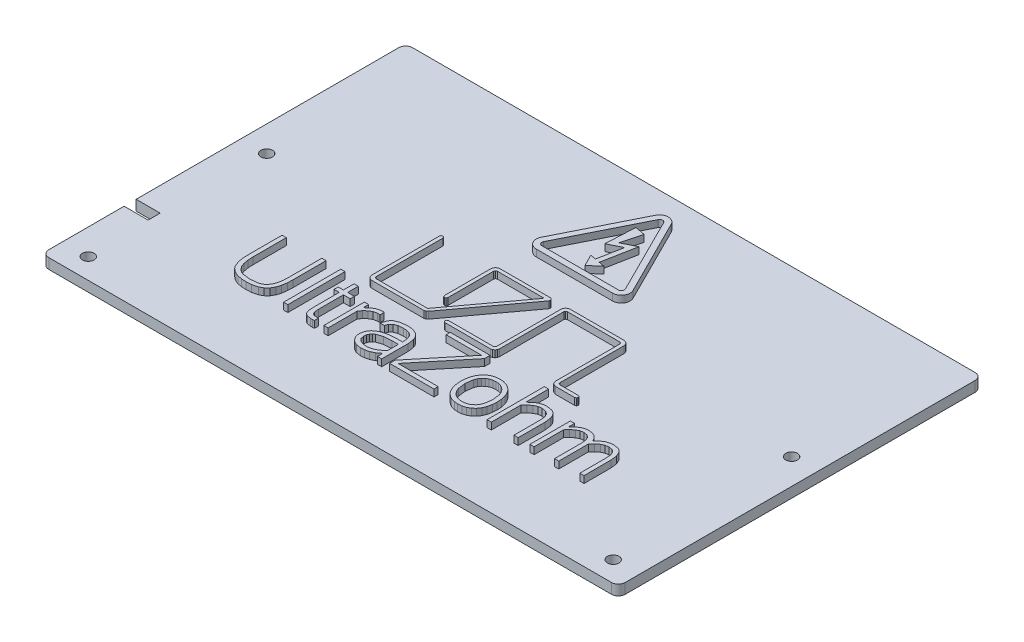
from build123d import *

# Parameters (mm, degrees)
AUFSATZ_LINEAR_AUSTRAGEN1_DEPTH = 3
SKIZZE4_W                       = 7
SKIZZE4_H                       = 3.5
SCHNITT_LINEAR_AUSTRAGEN3_DEPTH = 3
SKIZZE9_W                       = 1.236063568
SKIZZE9_H                       = 16.679437304
AUFSATZ_LINEAR_AUSTRAGEN2_DEPTH = 2
SKIZZE10_R                      = 1.7
SCHNITT_LINEAR_AUSTRAGEN4_DEPTH = 100.368002898
AUFSATZ_LINEAR_AUSTRAGEN3_DEPTH = 2


with BuildPart() as part:
    # Skizze1 → Aufsatz-Linear austragen1 (new body)
    with BuildSketch(Plane(origin=(0, 0, 0), x_dir=(1, 0, 0), z_dir=(0, 1, 0))):
        with BuildLine():
            Line((-82, -53), (82, -53))
            ThreePointArc((82, -53), (83.414213562, -52.414213562), (84, -51))
            Line((84, -51), (84, 51))
            ThreePointArc((84, 51), (83.414213562, 52.414213562), (82, 53))
            Line((82, 53), (-82, 53))
            ThreePointArc((-82, 53), (-83.414213562, 52.414213562), (-84, 51))
            Line((-84, 51), (-84, -51))
            ThreePointArc((-84, -51), (-83.414213562, -52.414213562), (-82, -53))
        make_face()
    extrude(amount=AUFSATZ_LINEAR_AUSTRAGEN1_DEPTH)

    # Skizze4 → Schnitt-Linear austragen3 (cut)
    with BuildSketch(Plane(origin=(0, 3, 0), x_dir=(1, 0, 0), z_dir=(0, 1, 0))):
        with Locations((-80.5, -27.3)):
            Rectangle(SKIZZE4_W, SKIZZE4_H)
    extrude(amount=-SCHNITT_LINEAR_AUSTRAGEN3_DEPTH, mode=Mode.SUBTRACT)

    # Skizze9 → Aufsatz-Linear austragen2 (add)
    # profile 1 of 11: a face of its own
    with BuildSketch(Plane(origin=(0, 3, 0), x_dir=(1, 0, 0), z_dir=(0, 1, 0))):
        Polygon((-12.039092375, -13.675479008), (-27.170980831, -13.675479008), (-27.701356199, -13.567530024), (-28.134310375, -13.274919992), (-28.426135039, -12.841435464), (-28.533121871, -12.310865024), (-28.533121871, 7.337595552), (-28.381067311, 7.704687528), (-28.013975335, 7.856742088), (-27.648480511, 7.7038158), (-27.497301743, 7.337595552), (-27.497301743, -12.108150672), (-27.345098847, -12.474371936), (-26.978155207, -12.62482528), (-12.039092375, -12.62482528), (-11.930324495, -12.56795976), (2.299238105, 6.714623976), (2.311539833, 6.858130928), (2.187994233, 6.932171928), (-11.228238015, 6.932171928), (-11.595333039, 6.780118384), (-11.747388615, 6.413025392), (-11.747388615, -6.906791504), (-11.897839927, -7.273732096), (-12.264055095, -7.42593804), (-12.631150119, -7.273884496), (-12.783205695, -6.906791504), (-12.783205695, 6.595962288), (-12.676161967, 7.126167984), (-12.384244847, 7.559139432), (-11.951274415, 7.851058584), (-11.421068719, 7.958103328), (3.164480977, 7.958103328), (3.535614601, 7.87180124), (3.797830993, 7.595339512), (3.864397281, 7.22016424), (3.713297761, 6.870368648), (-11.102156479, -13.181048704), (-11.514970487, -13.533725672), align=None)
    # profile 2 of 11: a face of its own
    with BuildSketch(Plane(origin=(0, 3, 0), x_dir=(1, 0, 0), z_dir=(0, 1, 0))):
        Polygon((31.937562369, -13.675479008), (26.390110929, -13.675479008), (25.859735561, -13.567530024), (25.426781385, -13.274919992), (25.134956721, -12.841435464), (25.027969889, -12.310865024), (25.027969889, 6.405603512), (24.876790105, 6.771824776), (24.511293249, 6.924750048), (9.218725409, 6.924750048), (8.853228553, 6.771824776), (8.702048769, 6.405603512), (8.702048769, -12.298504368), (8.602210513, -12.823374032), (8.308500153, -13.269681496), (7.865941729, -13.569011352), (7.342376609, -13.675479008), (-5.851360783, -13.675479008), (-6.218455807, -13.523425464), (-6.370511383, -13.156332472), (-6.218455807, -12.78923948), (-5.851360783, -12.637185936), (7.147081089, -12.637185936), (7.514016601, -12.486728528), (7.666216449, -12.120511328), (7.666216449, 6.595957208), (7.769904329, 7.1172282), (8.065182377, 7.559139432), (8.507095641, 7.854414432), (9.028367649, 7.958098248), (24.701640849, 7.958098248), (25.222912857, 7.854414432), (25.664826121, 7.559139432), (25.960104169, 7.1172282), (26.063792049, 6.595957208), (26.063792049, -12.1106226), (26.215994945, -12.476842848), (26.582937569, -12.627297208), (31.937562369, -12.627297208), (32.303052113, -12.780225528), (32.454228849, -13.146443744), (32.306584745, -13.51906276), align=None)
    # profile 3 of 11: a face of its own
    with BuildSketch(Plane(origin=(0, 3, 0), x_dir=(1, 0, 0), z_dir=(0, 1, 0))):
        Polygon((-45.244696271, -32.340032992), (-46.541147831, -32.274633072), (-47.815708655, -32.028544664), (-48.741563039, -31.686347736), (-49.590694183, -31.183077216), (-50.213803935, -30.61553352), (-50.710567991, -29.934654008), (-51.340960431, -28.41182444), (-51.610421919, -26.735722128), (-51.664808399, -25.044788248), (-51.664808399, -15.35652416), (-50.428745847, -15.35652416), (-50.428745847, -24.997817552), (-50.361680703, -26.559673712), (-50.082647479, -28.097864184), (-49.693990903, -29.09524192), (-49.069075719, -29.964319176), (-48.317399295, -30.533673384), (-47.439944103, -30.879005688), (-45.237280487, -31.126218808), (-43.012366471, -30.879005688), (-42.131722055, -30.534699544), (-41.383235871, -29.956903392), (-40.773828911, -29.084592208), (-40.394384407, -28.090447384), (-40.122309767, -26.55543496), (-40.058175783, -24.997817552), (-40.058175783, -15.35652416), (-38.822112215, -15.35652416), (-38.822112215, -25.047260176), (-38.886515439, -26.592649008), (-39.113823087, -28.122585496), (-39.490919615, -29.326949864), (-40.127394847, -30.416718576), (-41.015514991, -31.26682), (-42.100151887, -31.845607768), (-43.649391359, -32.239310816), align=None)
    # profile 4 of 11: a face of its own
    with BuildSketch(Plane(origin=(0, 3, 0), x_dir=(1, 0, 0), z_dir=(0, 1, 0))):
        with Locations((-33.912468999, -23.696242812)):
            Rectangle(SKIZZE9_W, SKIZZE9_H)
    # profile 5 of 11: a face of its own
    with BuildSketch(Plane(origin=(0, 3, 0), x_dir=(1, 0, 0), z_dir=(0, 1, 0))):
        Polygon((-25.430603311, -32.142262496), (-25.952222791, -32.189232176), (-26.473841255, -32.204065776), (-27.756874503, -31.981574984), (-28.182177183, -31.71129968), (-28.498511831, -31.319044432), (-28.829777615, -30.216476152), (-28.906414495, -28.668925272), (-28.906414495, -21.450315376), (-30.426772135, -21.450315376), (-30.426772135, -20.231558352), (-28.906414495, -20.231558352), (-28.906414495, -17.136455576), (-27.670350927, -17.136455576), (-27.670350927, -20.229085408), (-25.719844287, -20.229085408), (-25.719844287, -21.447844464), (-27.670350927, -21.447844464), (-27.670350927, -28.772754376), (-27.561577967, -29.939597864), (-27.240200911, -30.6095442), (-26.711166663, -30.913615728), (-25.996721559, -30.982835808), (-25.705010687, -30.982835808), (-25.428133415, -30.968002208), align=None)
    # profile 6 of 11: a face of its own
    with BuildSketch(Plane(origin=(0, 3, 0), x_dir=(1, 0, 0), z_dir=(0, 1, 0))):
        Polygon((-17.304725735, -21.175910032), (-17.673073487, -21.146242832), (-18.120525983, -21.146242832), (-19.136570687, -21.358845912), (-20.073506583, -21.9150734), (-20.901668503, -22.691321784), (-21.561726111, -23.581286984), (-21.561726111, -32.035961464), (-22.797789679, -32.035961464), (-22.797789679, -20.231558352), (-21.561726111, -20.231558352), (-21.561726111, -21.860688952), (-20.525904967, -20.871838504), (-19.537054519, -20.276056104), (-18.607534407, -19.99423396), (-17.794202023, -19.92748276), (-17.564296463, -19.92748276), (-17.317087407, -19.94973316), align=None)
    # profile 7 of 11: a face of its own
    with BuildSketch(Plane(origin=(0, 3, 0), x_dir=(1, 0, 0), z_dir=(0, 1, 0))):
        Polygon((-7.169005087, -30.51313088), (-8.405070687, -31.41792968), (-9.579329959, -31.981573968), (-10.723924063, -32.263397128), (-11.875935983, -32.340034008), (-13.334489327, -32.105181544), (-14.501329767, -31.435235208), (-15.277576119, -30.382109552), (-15.494689223, -29.716684416), (-15.561879335, -29.019968512), (-15.459799783, -28.076050664), (-15.119174607, -27.206927688), (-14.564187655, -26.456335336), (-13.819022775, -25.868007328), (-12.838516735, -25.374818576), (-11.639846031, -25.02253988), (-10.223008631, -24.811173272), (-8.588006567, -24.740717736), (-7.176422903, -24.740717736), (-7.267896431, -23.309354584), (-7.698041367, -22.174649208), (-8.137960223, -21.72616852), (-8.686888767, -21.420650208), (-9.572363247, -21.197369984), (-10.484123679, -21.146244864), (-11.947010263, -21.275413008), (-12.993340911, -21.662918456), (-13.670634959, -22.332625016), (-13.982188311, -23.23271872), (-15.195998431, -23.23271872), (-14.773264199, -21.771692432), (-14.383906583, -21.202484528), (-13.875887279, -20.740815144), (-12.463682839, -20.129582432), (-10.496485351, -19.927485808), (-9.428186751, -19.991335312), (-8.385291199, -20.231558352), (-7.625962263, -20.584612256), (-6.971240687, -21.106690968), (-6.492681319, -21.752768416), (-6.180157687, -22.49355332), (-5.932947615, -24.327871216), (-5.932947615, -32.035961464), (-7.169005087, -32.035961464), align=None)
        Polygon((-7.169005087, -25.95947476), (-9.025570335, -25.95947476), (-11.359875039, -26.149828456), (-13.013111255, -26.720889544), (-13.566031663, -27.1068842), (-13.982699359, -27.621065544), (-14.242747607, -28.229644464), (-14.325812719, -28.898832864), (-14.122321127, -29.824619176), (-13.495178871, -30.535380264), (-12.513127495, -30.974800264), (-11.223295175, -31.121273936), (-10.002066223, -30.930921256), (-8.887138303, -30.436495016), (-7.927946927, -29.759132896), (-7.169005087, -29.03480008), align=None, mode=Mode.SUBTRACT)
    # profile 8 of 11: a face of its own
    with BuildSketch(Plane(origin=(0, 3, 0), x_dir=(1, 0, 0), z_dir=(0, 1, 0))):
        Polygon((9.295352129, -32.035961464), (-3.638808439, -32.035961464), (-3.638808439, -30.421662432), (7.713186129, -16.577755144), (-2.640075359, -16.577755144), (-2.640075359, -15.35652416), (8.978918929, -15.35652416), (8.978918929, -16.988127704), (-2.392856143, -30.817202408), (9.295352129, -30.817202408), align=None)
    # profile 9 of 11: a face of its own
    with BuildSketch(Plane(origin=(0, 3, 0), x_dir=(1, 0, 0), z_dir=(0, 1, 0))):
        Polygon((16.489241729, -19.927485808), (17.610830545, -20.026980656), (18.689430369, -20.35022004), (19.596741737, -20.862788992), (20.363056689, -21.56897808), (20.997069137, -22.487404488), (21.433493969, -23.51454188), (21.714390537, -24.812241088), (21.808023065, -26.130052016), (21.714390537, -27.447861928), (21.433493969, -28.745561136), (20.999035097, -29.778007128), (20.368014769, -30.703485592), (19.599942137, -31.40910572), (18.691909409, -31.922243632), (17.618298145, -32.232529016), (16.515200529, -32.335957816), (15.412102913, -32.232529016), (14.338491649, -31.922243632), (13.434324801, -31.414318816), (12.672282129, -30.710901376), (12.037108393, -29.785482856), (11.596907089, -28.75297692), (11.312275705, -27.44807224), (11.217397561, -26.122635216), (11.312275705, -24.797197176), (11.596907089, -23.492292496), (12.031964385, -22.466377352), (12.664865329, -21.54920164), (13.432033721, -20.847307184), (14.338491649, -20.337858368), (15.393250017, -20.02462252), align=None)
        Polygon((16.489241729, -31.121273936), (17.330503953, -31.048072152), (18.140627809, -30.809786624), (18.838888033, -30.414702832), (19.423663089, -29.865433928), (19.920670985, -29.122700336), (20.259241809, -28.295633664), (20.560840393, -26.117690344), (20.259241809, -23.93974804), (19.921611801, -23.120357248), (19.423663089, -22.387251272), (18.836569521, -21.847369192), (18.140627809, -21.457732176), (17.322192057, -21.224160888), (16.481830009, -21.146303792), (15.641467961, -21.224160888), (14.823032209, -21.457732176), (14.127090497, -21.847369192), (13.539996929, -22.387251272), (13.044294593, -23.119959992), (12.711835009, -23.93974804), (12.420140393, -26.117690344), (12.711835009, -28.295633664), (13.045393905, -29.123013264), (13.539996929, -29.865433928), (14.124771985, -30.414702832), (14.823032209, -30.809786624), (15.640577945, -31.048758968), align=None, mode=Mode.SUBTRACT)
    # profile 10 of 11: a face of its own
    with BuildSketch(Plane(origin=(0, 3, 0), x_dir=(1, 0, 0), z_dir=(0, 1, 0))):
        Polygon((26.014343329, -21.984294496), (27.156469569, -20.916336256), (28.249147089, -20.293360616), (29.262718849, -20.004122688), (30.174934449, -19.927485808), (31.781046553, -20.195866272), (32.412019129, -20.531341344), (32.928269049, -21.001006648), (33.329797329, -21.604862184), (33.616602953, -22.342907952), (33.846047249, -24.221570184), (33.846047249, -32.035961464), (32.609981649, -32.035961464), (32.609981649, -24.327871216), (32.464124689, -22.90392588), (31.989479969, -21.915075432), (31.129181969, -21.33659856), (29.831313089, -21.146244864), (28.816412401, -21.3009268), (27.888213089, -21.739555336), (26.888581865, -22.511397328), (26.006926529, -23.415656632), (26.006926529, -32.035961464), (24.770860929, -32.035961464), (24.770860929, -15.356523144), (26.006926529, -15.356523144), align=None)
    # profile 11 of 11: a face of its own
    with BuildSketch(Plane(origin=(0, 3, 0), x_dir=(1, 0, 0), z_dir=(0, 1, 0))):
        Polygon((53.027273809, -32.035961464), (51.791208209, -32.035961464), (51.791208209, -24.327871216), (51.658947361, -22.873642984), (51.262166849, -21.892827064), (50.525479473, -21.33659856), (49.395713889, -21.15118872), (48.394865497, -21.310968944), (47.482291249, -21.751914976), (46.511623137, -22.528470192), (45.677641569, -23.450266672), (45.677641569, -32.04090532), (44.441575969, -32.04090532), (44.441575969, -24.327871216), (44.327855089, -22.881677512), (43.934785009, -21.892827064), (43.193145649, -21.329182776), (42.080696769, -21.146244864), (41.112194769, -21.304160728), (40.236494209, -21.74697112), (39.293344457, -22.533168176), (38.471387249, -23.4453218), (38.471387249, -32.035961464), (37.235331809, -32.035961464), (37.235331809, -20.231558352), (38.471387249, -20.231558352), (38.471387249, -21.984294496), (39.630815969, -20.894087888), (40.659231489, -20.276056104), (41.581322609, -19.99423396), (42.416901329, -19.92748276), (43.445286369, -20.046138352), (44.394606289, -20.458989952), (45.127412545, -21.172653752), (45.578754289, -22.090593496), (46.552773169, -21.030052056), (47.598481009, -20.367521504), (48.666439249, -20.026368008), (49.709678209, -19.927480728), (51.155562033, -20.195861192), (51.723454217, -20.531336264), (52.187981609, -21.001001568), (52.806937953, -22.342902872), (53.012430049, -24.221565104), align=None)
    extrude(amount=AUFSATZ_LINEAR_AUSTRAGEN2_DEPTH)

    # Skizze10 → Schnitt-Linear austragen4 (cut, through all)
    with BuildSketch(Plane(origin=(0, 3, 0), x_dir=(1, 0, 0), z_dir=(0, 1, 0))):
        with Locations(Location((-76.5, -47, 0), (0, 0, 270))):
            Circle(SKIZZE10_R)
        with Locations(Location((76.5, -47, 0), (0, 0, 270))):
            Circle(SKIZZE10_R)
        with Locations(Location((76.5, 5, 0), (0, 0, 270))):
            Circle(SKIZZE10_R)
        with Locations(Location((-76.5, 5, 0), (0, 0, 270))):
            Circle(SKIZZE10_R)
    extrude(amount=-SCHNITT_LINEAR_AUSTRAGEN4_DEPTH, mode=Mode.SUBTRACT)

    # Skizze14 → Aufsatz-Linear austragen3 (add)
    # profile 1 of 2: a face of its own
    with BuildSketch(Plane(origin=(0, 3, 0), x_dir=(1, 0, 0), z_dir=(0, 1, 0))):
        with BuildLine():
            Line((13.402038734, 21.875870529), (2.271845065, 44.136257866))
            add(Edge.make_bspline(
                [(2.271845065, 44.136257866), (1.569806331, 45.540335333), (0, 45.540335333), (-1.569806331, 45.540335333), (-2.271845065, 44.136257866)],
                knots=[0, 0, 0, 0.5, 0.5, 1, 1, 1], degree=2, weights=[0.876030899, 0.796179574, 1, 0.796179574, 0.876030899]))
            Line((-2.271845065, 44.136257866), (-13.402038734, 21.875870529))
            add(Edge.make_bspline(
                [(-13.402038734, 21.875870529), (-13.670193669, 21.339560659), (-13.670193669, 20.739947996)],
                knots=[0, 0, 0, 1, 1, 1], degree=2, weights=[1, 0.973248989, 1]))
            add(Edge.make_bspline(
                [(-13.670193669, 20.739947996), (-13.670193657, 18.199948008), (-11.130193669, 18.199947996)],
                knots=[0, 0, 0, 1, 1, 1], degree=2, weights=[1, 0.707106783, 0.999999996]))
            Line((-11.130193669, 18.199947996), (11.130193669, 18.199947996))
            add(Edge.make_bspline(
                [(11.130193669, 18.199947996), (12.546336419, 18.199947996), (13.290846722, 19.404590972), (14.035357025, 20.609233947), (13.402038734, 21.875870529)],
                knots=[0, 0, 0, 0.5, 0.5, 1, 1, 1], degree=2, weights=[1, 0.873421752, 1, 0.873421752, 1]))
        make_face()
        with BuildLine():
            add(Edge.make_bspline(
                [(0.795145773, 43.397908221), (0.549432216, 43.889335334), (0, 43.889335334), (-0.549432216, 43.889335333), (-0.795145773, 43.39790822)],
                knots=[0, 0, 0, 0.5, 0.5, 1, 1, 1], degree=2, weights=[1, 0.850650808, 1, 0.850650808, 1]))
            Line((-0.795145773, 43.39790822), (-11.925337371, 21.137525024))
            add(Edge.make_bspline(
                [(-12.019193669, 20.739947996), (-12.019193669, 20.949814872), (-11.925337371, 21.137525024)],
                knots=[0, 0, 0, 1, 1, 1], degree=2, weights=[1, 0.910926263, 0.876030159]))
            add(Edge.make_bspline(
                [(-12.019193669, 20.739947996), (-12.019193669, 19.850948004), (-11.130193676, 19.850947996)],
                knots=[0, 0, 0, 1, 1, 1], degree=2, weights=[1, 0.707106783, 0.999999996]))
            Line((-11.130193676, 19.850947996), (11.130193676, 19.850947996))
            add(Edge.make_bspline(
                [(11.130193676, 19.850947996), (12.019193668, 19.850948003), (12.019193669, 20.739947996), (12.019193669, 20.949812428), (11.925339441, 21.137520883)],
                knots=[0, 0, 0, 0.7668044, 0.7668044, 1, 1, 1], degree=2, weights=[0.999999997, 0.707106783, 1, 0.910927207, 0.876030899]))
            Line((11.925339441, 21.137520883), (0.795145773, 43.397908221))
        make_face(mode=Mode.SUBTRACT)
    # profile 2 of 2: a face of its own
    with BuildSketch(Plane(origin=(0, 3, 0), x_dir=(1, 0, 0), z_dir=(0, 1, 0))):
        Polygon((3.02960379, 23.71402973), (0.117149408, 21.153747598), (-1.639037272, 24.611093902), (0.00980378, 24.294274465), (1.38465601, 31.449494542), (-2.482024316, 29.537876032), (-2.054159117, 38.167591568), (0.884994787, 37.602842719), (-0.643230248, 31.821072951), (3.247195835, 33.744430944), (1.380762738, 24.030849167), align=None)
    extrude(amount=AUFSATZ_LINEAR_AUSTRAGEN3_DEPTH)


solid = part.part
